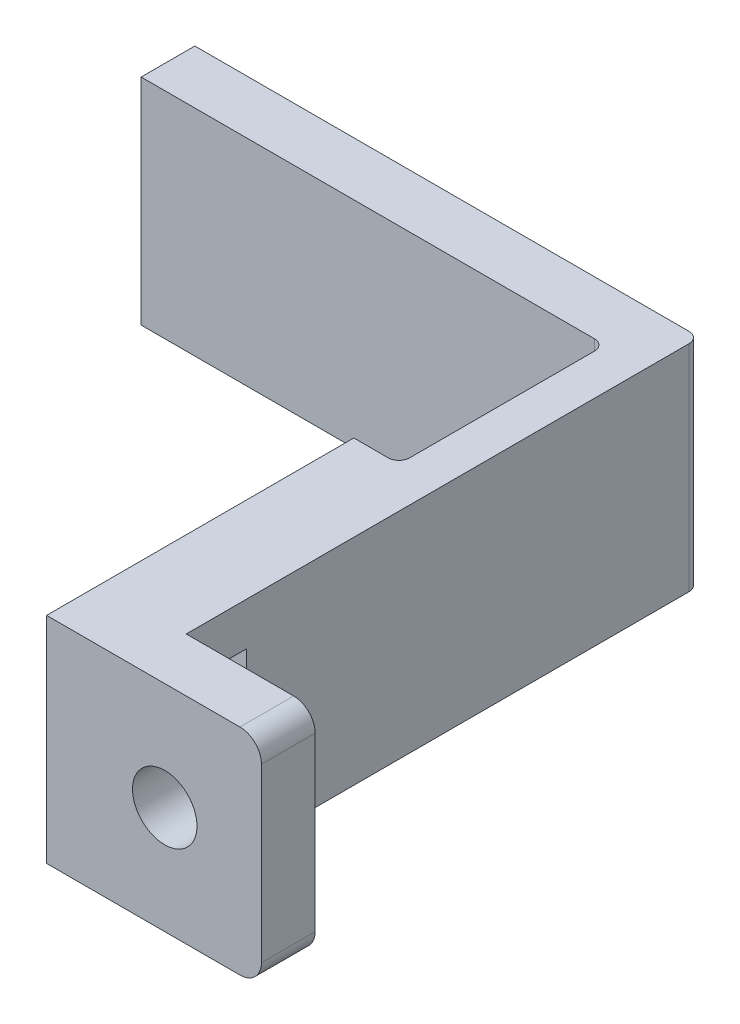
from build123d import *

# Parameters (mm, degrees)
EXTRUDE_1_DEPTH     = 10
SKETCH_2_R          = 1.5
CUT_EXTRUDE_1_DEPTH = 10
FILLET_1_R          = 0.5
FILLET_2_R          = 0.5
FILLET_3_R          = 1
SKETCH_3_W          = 2.8
SKETCH_3_H          = 6
CUT_EXTRUDE_2_DEPTH = 2


with BuildPart() as part:
    # 草图1 → 凸台-拉伸1 (new body)
    with BuildSketch(Plane(origin=(0, 0, 0), x_dir=(1, 0, 0), z_dir=(0, 1, 0))):
        Polygon((0, 0), (10, 0), (10, 2.5), (4, 2.5), (4, 26.4), (-19.5, 26.4), (-19.5, 23.9), (2.1, 23.9), (2.1, 14.3), (0, 14.3), align=None)
    extrude(amount=EXTRUDE_1_DEPTH)

    # 草图2 → 切除-拉伸1 (cut)
    with BuildSketch(Plane(origin=(0, 0, -2.5), x_dir=(-1, 0, 0), z_dir=(0, 0, -1))):
        with Locations((-5.5, 5)):
            Circle(SKETCH_2_R)
    extrude(amount=-CUT_EXTRUDE_1_DEPTH, mode=Mode.SUBTRACT)

    # 圆角1
    fillet_1_edges = [part.edges().sort_by_distance(p)[0] for p in [
        (2.1, 5, -23.9),
        (4, 5, -26.4),
    ]]
    fillet(fillet_1_edges, radius=FILLET_1_R)

    # 圆角2
    fillet_2_edges = [part.edges().sort_by_distance(p)[0] for p in [
        (2.1, 5, -14.3),
    ]]
    fillet(fillet_2_edges, radius=FILLET_2_R)

    # 圆角3
    fillet_3_edges = [part.edges().sort_by_distance(p)[0] for p in [
        (10, 10, -1.25),
        (10, 0, -1.25),
    ]]
    fillet(fillet_3_edges, radius=FILLET_3_R)

    # 草图3 → 切除-拉伸2 (cut)
    with BuildSketch(Plane(origin=(4, 0, 0), x_dir=(0, 0, -1), z_dir=(1, 0, 0))):
        with Locations((3.9, 5)):
            Rectangle(SKETCH_3_W, SKETCH_3_H)
    extrude(amount=-CUT_EXTRUDE_2_DEPTH, mode=Mode.SUBTRACT)


solid = part.part
